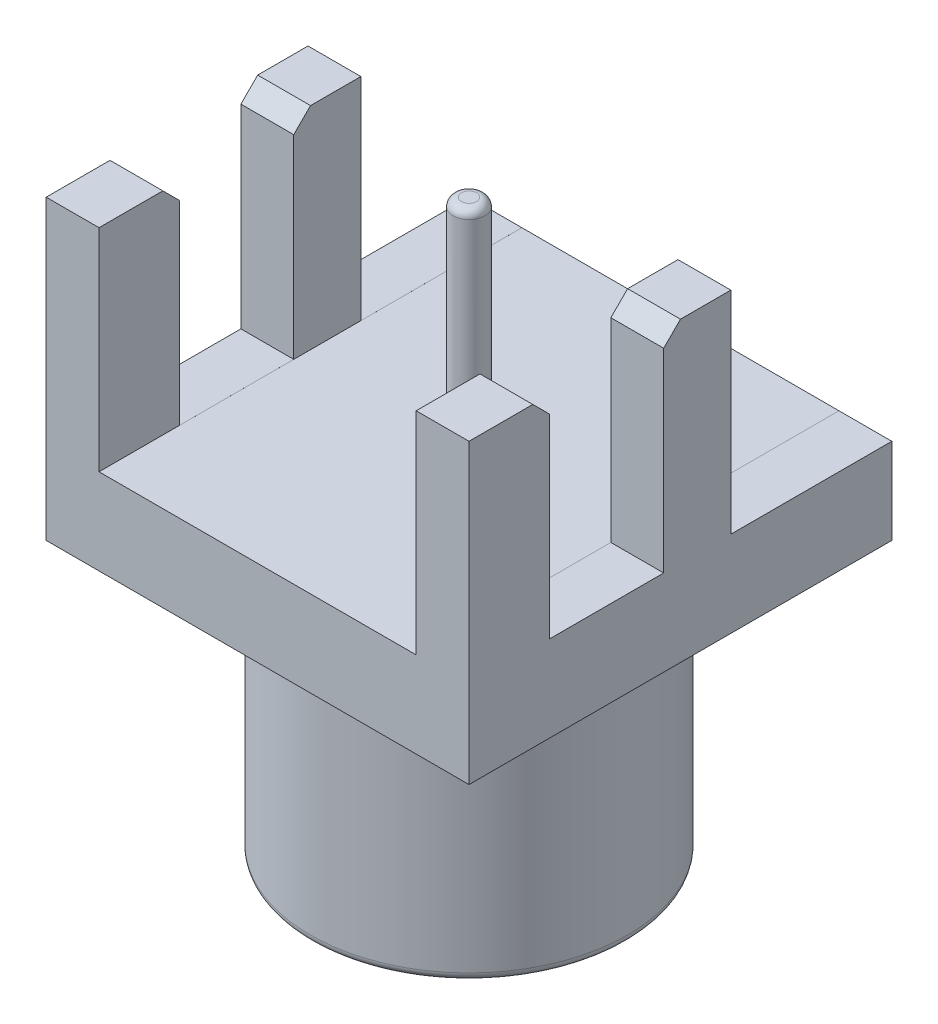
from build123d import *

# Parameters (mm, degrees)
SKETCH1_W           = 6.4
SKETCH1_H           = 6.4
BOSS_EXTRUDE1_DEPTH = 1.3
SKETCH2_W           = 0.8
SKETCH2_H           = 6.4
BOSS_EXTRUDE2_DEPTH = 0.0001
SKETCH3_W           = 0.8
SKETCH3_H           = 1.22
SKETCH3_H_2         = 1.016
BOSS_EXTRUDE3_DEPTH = 3.2
CHAMFER1_SIZE       = 0.254
SKETCH4_R           = 0.24
BOSS_EXTRUDE4_DEPTH = 3.2001
FILLET1_R           = 0.125
SKETCH5_R           = 2.4
SKETCH5_R_2         = 2.0825
SKETCH5_R_3         = 0.381
BOSS_EXTRUDE5_DEPTH = 4.1
CUT_EXTRUDE1_START  = -1.524
SKETCH7_R           = 0.381
CUT_EXTRUDE1_DEPTH  = 1.524
SKETCH8_R           = 0.381
BOSS_EXTRUDE6_DEPTH = 0.762
BOSS_EXTRUDE6_TAPER = 15
FILLET2_R           = 0.127
FILLET3_R           = 0.127


with BuildPart() as part:
    # Sketch1 → Boss-Extrude1 (new body)
    with BuildSketch(Plane(origin=(0, 0, 0), x_dir=(1, 0, 0), z_dir=(0, 1, 0))):
        Rectangle(SKETCH1_W, SKETCH1_H)
    extrude(amount=BOSS_EXTRUDE1_DEPTH)

    # Sketch2 → Boss-Extrude2 (add)
    with BuildSketch(Plane(origin=(0, 1.3, 0), x_dir=(1, 0, 0), z_dir=(0, 1, 0))):
        with Locations((-2.8, 0)):
            Rectangle(SKETCH2_W, SKETCH2_H)
        with Locations((2.8, 0)):
            Rectangle(SKETCH2_W, SKETCH2_H)
    extrude(amount=BOSS_EXTRUDE2_DEPTH)

    # Sketch3 → Boss-Extrude3 (add)
    with BuildSketch(Plane(origin=(0, 1.3001, 0), x_dir=(1, 0, 0), z_dir=(0, 1, 0))):
        with Locations((-2.8, -2.59)):
            Rectangle(SKETCH3_W, SKETCH3_H)
        with Locations((-2.8, 0.2552)):
            Rectangle(SKETCH3_W, SKETCH3_H_2)
        with Locations((2.8, 0.2552)):
            Rectangle(SKETCH3_W, SKETCH3_H_2)
        with Locations((2.8, -2.59)):
            Rectangle(SKETCH3_W, SKETCH3_H)
    extrude(amount=BOSS_EXTRUDE3_DEPTH)

    # Chamfer1
    chamfer1_edges = [part.edges().sort_by_distance(p)[0] for p in [
        (-2.8, 4.5001, 1.98),
        (-2.8, 4.5001, 0.2528),
        (2.8, 4.5001, 0.2528),
        (2.8, 4.5001, 1.98),
    ]]
    chamfer(chamfer1_edges, length=CHAMFER1_SIZE)

    # Sketch4 → Boss-Extrude4 (add)
    with BuildSketch(Plane(origin=(0, 1.3, 0), x_dir=(1, 0, 0), z_dir=(0, 1, 0))):
        with Locations(Location((0, 0, 0), (0, 0, 90))):
            Circle(SKETCH4_R)
    extrude(amount=BOSS_EXTRUDE4_DEPTH)

    # Fillet1
    fillet1_edges = [part.edges().sort_by_distance(p)[0] for p in [
        (0, 4.5001, 0.24),
    ]]
    fillet(fillet1_edges, radius=FILLET1_R)

    # Sketch5 → Boss-Extrude5 (add)
    # profile 1 of 2: a face of its own
    with BuildSketch(Plane.XZ):
        with Locations(Location((0, 0, 0), (0, 0, 270))):
            Circle(SKETCH5_R)
        with Locations(Location((0, 0, 0), (0, 0, 270))):
            Circle(SKETCH5_R_2, mode=Mode.SUBTRACT)
    # profile 2 of 2: a face of its own
    with BuildSketch(Plane.XZ):
        with Locations(Location((0, 0, 0), (0, 0, 270))):
            Circle(SKETCH5_R_3)
    extrude(amount=BOSS_EXTRUDE5_DEPTH)

    # Sketch7 → Cut-Extrude1 (cut)
    with BuildSketch(Plane.XZ.offset(4.1).offset(CUT_EXTRUDE1_START)):
        with Locations(Location((0, 0, 0), (0, 0, 270))):
            Circle(SKETCH7_R)
    extrude(amount=CUT_EXTRUDE1_DEPTH, mode=Mode.SUBTRACT)

    # Sketch8 → Boss-Extrude6 (add)
    with BuildSketch(Plane.XZ.offset(2.576)):
        with Locations(Location((0, 0, 0), (0, 0, 270))):
            Circle(SKETCH8_R)
    extrude(amount=BOSS_EXTRUDE6_DEPTH, taper=BOSS_EXTRUDE6_TAPER)

    # Fillet2
    fillet2_edges = [part.edges().sort_by_distance(p)[0] for p in [
        (0, -3.338, 0.176822715),
    ]]
    fillet(fillet2_edges, radius=FILLET2_R)

    # Fillet3
    fillet3_edges = [part.edges().sort_by_distance(p)[0] for p in [
        (0, -4.1, 2.4),
    ]]
    fillet(fillet3_edges, radius=FILLET3_R)


solid = part.part
